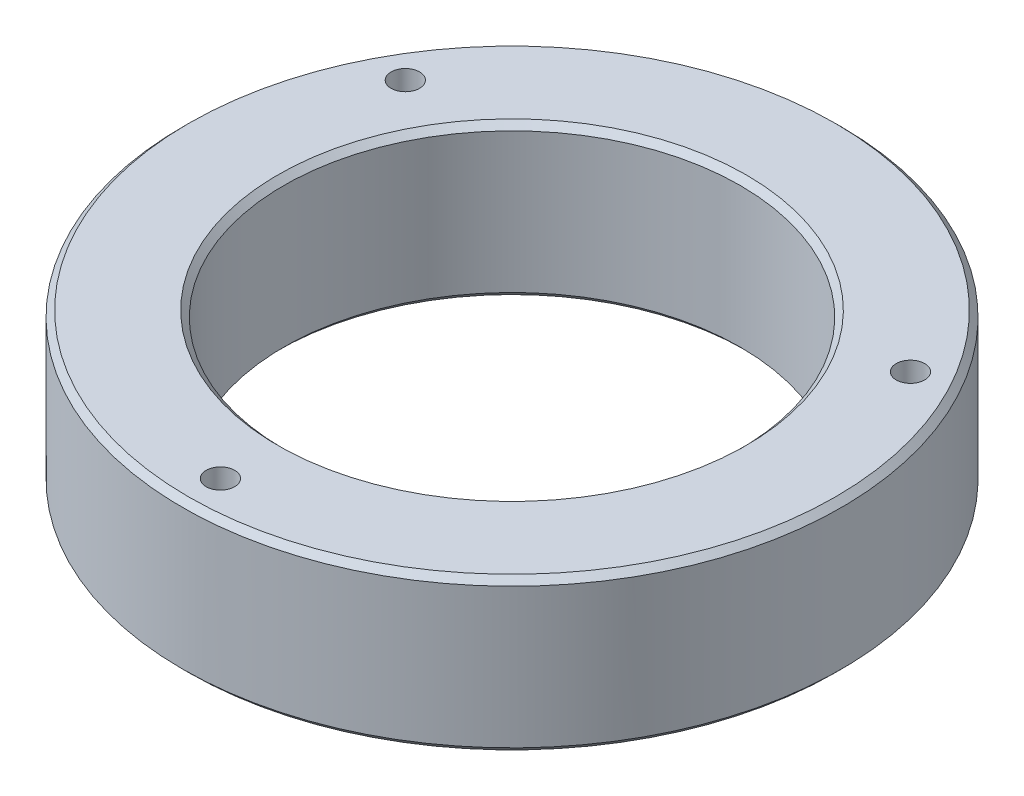
from build123d import *

# Parameters (mm, degrees)
SKETCH1_W                                        = 38.1
SKETCH1_H                                        = 25.3746
CBORE_FOR_1_4_SOCKET_HEAD_CAP_SCREW1_D           = 7.1374
CBORE_FOR_1_4_SOCKET_HEAD_CAP_SCREW1_DEPTH       = 38.1
CBORE_FOR_1_4_SOCKET_HEAD_CAP_SCREW1_CBORE_D     = 11.1252
CBORE_FOR_1_4_SOCKET_HEAD_CAP_SCREW1_CBORE_DEPTH = 9.652
CBORE_FOR_1_4_SOCKET_HEAD_CAP_SCREW1_TIP         = 2.144291291
F_3_8_16_TAPPED_HOLE2_D                          = 7.9375
F_3_8_16_TAPPED_HOLE2_DEPTH                      = 25.4
F_3_8_16_TAPPED_HOLE2_TIP                        = 2.384665582
CHAMFER1_SIZE                                    = 1.524


with BuildPart() as part:
    # Sketch1 → Revolve1 (revolve)
    with BuildSketch(Plane(origin=(0, 0, 0), x_dir=(0, 1, 0), z_dir=(0, 0, 1)), mode=Mode.PRIVATE) as revolve1_sk:
        with Locations((0, 69.8373)):
            Rectangle(SKETCH1_W, SKETCH1_H)
    revolve(revolve1_sk.sketch.rotate(Axis((0, -44.45, 0), (0, 1, 0)), 270), axis=Axis((0, -44.45, 0), (0, 1, 0)))

    # CBORE for 1/4 Socket Head Cap Screw1
    with Locations(Plane(origin=(0, -19.05, 0), x_dir=(-1, 0, 0), z_dir=(0, -1, 0))):
        with Locations((0, -73.025), (-63.246, 36.5252), (63.246, 36.5252)):
            CounterBoreHole(CBORE_FOR_1_4_SOCKET_HEAD_CAP_SCREW1_D / 2, CBORE_FOR_1_4_SOCKET_HEAD_CAP_SCREW1_CBORE_D / 2, CBORE_FOR_1_4_SOCKET_HEAD_CAP_SCREW1_CBORE_DEPTH, depth=CBORE_FOR_1_4_SOCKET_HEAD_CAP_SCREW1_DEPTH)
            with Locations((0, 0, -(CBORE_FOR_1_4_SOCKET_HEAD_CAP_SCREW1_DEPTH + CBORE_FOR_1_4_SOCKET_HEAD_CAP_SCREW1_TIP / 2))):  # 118° drill point
                Cone(0, CBORE_FOR_1_4_SOCKET_HEAD_CAP_SCREW1_D / 2, CBORE_FOR_1_4_SOCKET_HEAD_CAP_SCREW1_TIP, mode=Mode.SUBTRACT)

    # 3/8-16 Tapped Hole2
    with Locations(Plane(origin=(0, -19.05, 0), x_dir=(-1, 0, 0), z_dir=(0, -1, 0))):
        with Locations((-69.85, 0), (69.85, 0)):
            Hole(F_3_8_16_TAPPED_HOLE2_D / 2, depth=F_3_8_16_TAPPED_HOLE2_DEPTH)
            with Locations((0, 0, -(F_3_8_16_TAPPED_HOLE2_DEPTH + F_3_8_16_TAPPED_HOLE2_TIP / 2))):  # 118° drill point
                Cone(0, F_3_8_16_TAPPED_HOLE2_D / 2, F_3_8_16_TAPPED_HOLE2_TIP, mode=Mode.SUBTRACT)

    # Chamfer1
    chamfer1_edges = [part.edges().sort_by_distance(p)[0] for p in [
        (0, -19.05, 57.15),
        (0, 19.05, 57.15),
        (0, 19.05, 82.5246),
        (0, -19.05, 82.5246),
    ]]
    chamfer(chamfer1_edges, length=CHAMFER1_SIZE)


solid = part.part
